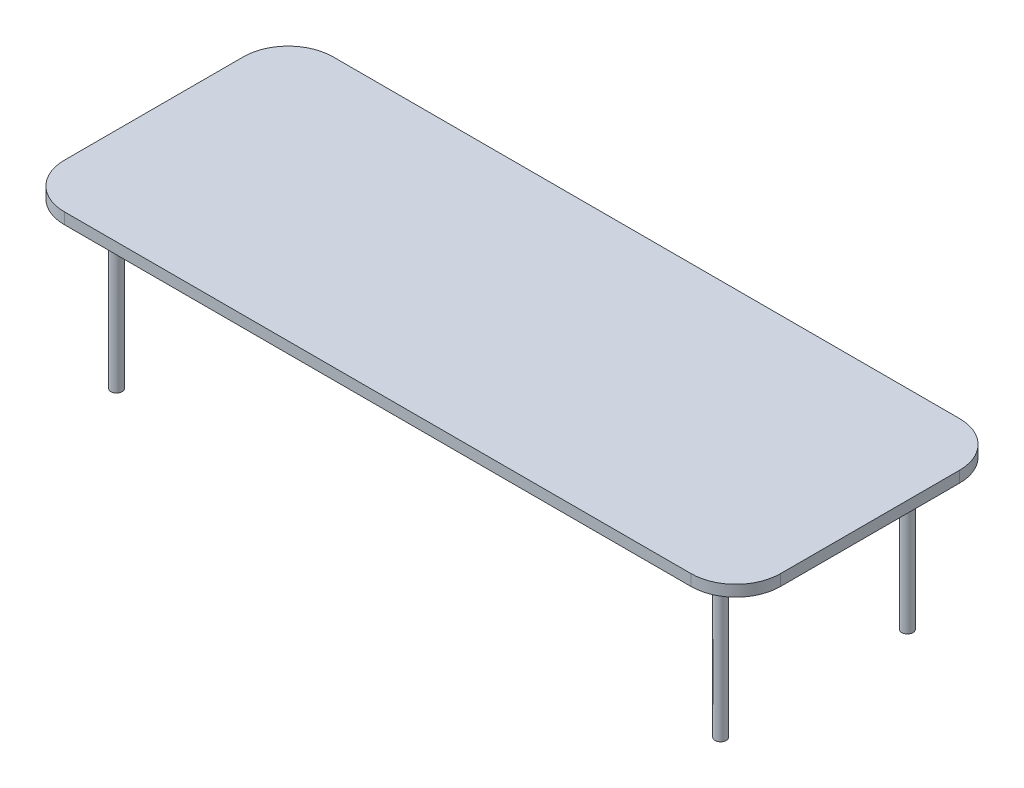
from build123d import *

# Parameters (mm, degrees)
BOSS_EXTRUDE1_DEPTH = 50.8
SKETCH2_R           = 25.4
BOSS_EXTRUDE2_DEPTH = 711.2


with BuildPart() as part:
    # Sketch1 → Boss-Extrude1 (new body)
    with BuildSketch(Plane(origin=(0, 0, 0), x_dir=(1, 0, 0), z_dir=(0, 1, 0))):
        with BuildLine():
            Line((-1422.4, 609.6), (1422.4, 609.6))
            ThreePointArc((1422.4, 609.6), (1566.084097937, 550.084097937), (1625.6, 406.4))
            Line((1625.6, 406.4), (1625.6, -406.4))
            ThreePointArc((1625.6, -406.4), (1566.084097937, -550.084097937), (1422.4, -609.6))
            Line((1422.4, -609.6), (-1422.4, -609.6))
            ThreePointArc((-1422.4, -609.6), (-1566.084097937, -550.084097937), (-1625.6, -406.4))
            Line((-1625.6, -406.4), (-1625.6, 406.4))
            ThreePointArc((-1625.6, 406.4), (-1566.084097937, 550.084097937), (-1422.4, 609.6))
        make_face()
    extrude(amount=BOSS_EXTRUDE1_DEPTH)

    # Sketch2 → Boss-Extrude2 (add)
    with BuildSketch(Plane.XZ):
        with Locations(Location((-1371.244481687, 424.064320522, 0), (0, 0, 90))):
            Circle(SKETCH2_R)
        with Locations(Location((-1371.244481687, -424.064320522, 0), (0, 0, 90))):
            Circle(SKETCH2_R)
        with Locations(Location((1371.244481687, -424.064320522, 0), (0, 0, 90))):
            Circle(SKETCH2_R)
        with Locations(Location((1371.244481687, 424.064320522, 0), (0, 0, 90))):
            Circle(SKETCH2_R)
    extrude(amount=BOSS_EXTRUDE2_DEPTH)


solid = part.part
